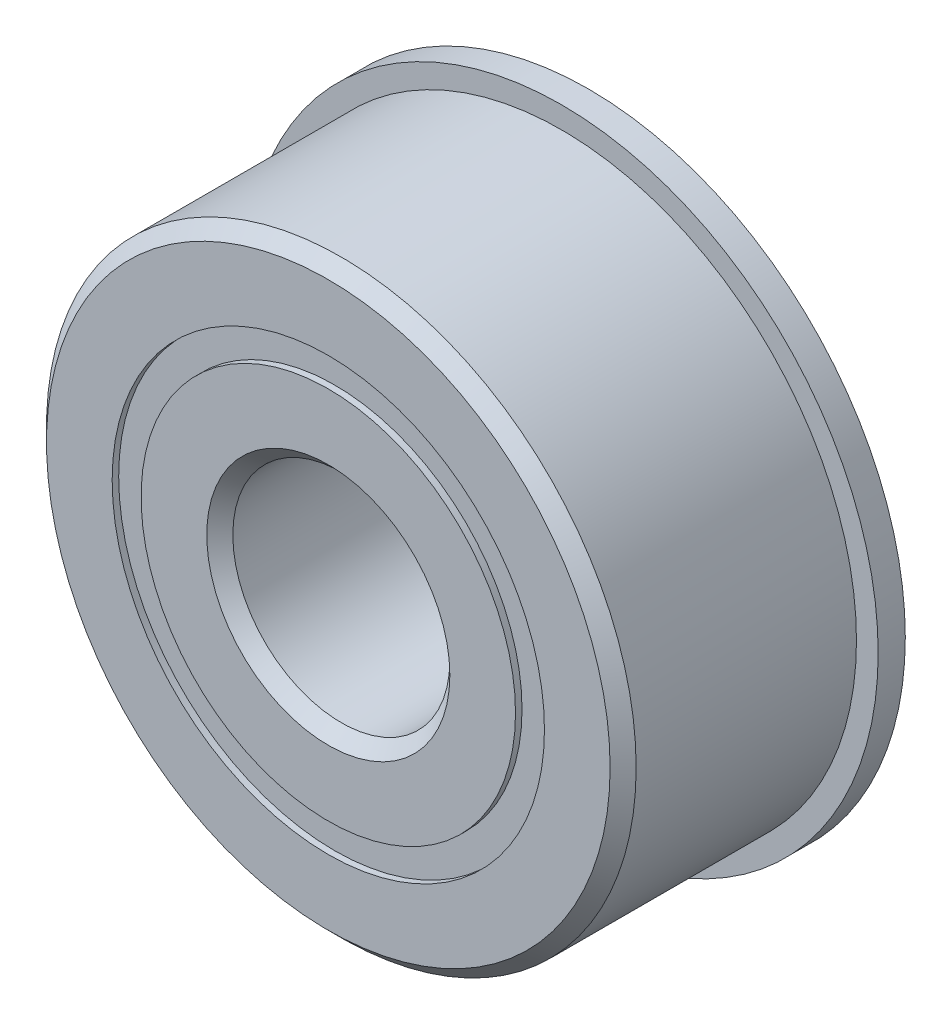
from build123d import *

# Parameters (mm, degrees)
CIRPATTERN1_COUNT = 8
SKETCH5_W         = 1.77075775
SKETCH5_H         = 0.8
SKETCH6_W         = 0.75
SKETCH6_H         = 2.775


with BuildPart() as part:
    # Sketch1 → Revolve1 (revolve)
    with BuildSketch(Plane(origin=(0, 0, 0), x_dir=(0, 0, -1), z_dir=(1, 0, 0))):
        with BuildLine():
            Line((3.24, 8.15), (-3.24, 8.15))
            Line((-3.24, 8.15), (-3.6, 7.79))
            Line((-3.6, 7.79), (-3.6, 5.975))
            Line((-3.6, 5.975), (-1.6, 5.975))
            ThreePointArc((-1.6, 5.975), (0, 7.22424225), (1.6, 5.975))
            Line((1.6, 5.975), (3.6, 5.975))
            Line((3.6, 5.975), (3.6, 7.79))
            Line((3.6, 7.79), (3.24, 8.15))
        make_face()
    revolve(axis=Axis((0, 0, 3.6), (0, 0, -1)))

    # Sketch6 → Revolve6 (revolve)
    with BuildSketch(Plane(origin=(0, 0, 0), x_dir=(0, 0, -1), z_dir=(1, 0, 0))):
        with Locations((3.225, 7.3625)):
            Rectangle(SKETCH6_W, SKETCH6_H)
    revolve(axis=Axis((0, 0, -3.6), (0, 0, 1)))


with BuildPart() as body_2:
    # Sketch3 → Revolve3 (revolve)
    with BuildSketch(Plane(origin=(0, 0, 0), x_dir=(0, 0, -1), z_dir=(1, 0, 0))):
        with BuildLine():
            Line((-3.6, 5.175), (-1.6, 5.175))
            ThreePointArc((-1.6, 5.175), (0, 3.92575775), (1.6, 5.175))
            Line((1.6, 5.175), (3.6, 5.175))
            Line((3.6, 5.175), (3.6, 3.36))
            Line((3.6, 3.36), (3.24, 3))
            Line((3.24, 3), (-3.24, 3))
            Line((-3.24, 3), (-3.6, 3.36))
            Line((-3.6, 3.36), (-3.6, 5.175))
        make_face()
    revolve(axis=Axis((0, 0, 3.6), (0, 0, -1)))


with BuildPart() as body_3:
    # Sketch4 → Revolve4 (revolve)
    with BuildSketch(Plane(origin=(0, 0, 0), x_dir=(0, 0, -1), z_dir=(1, 0, 0))):
        with BuildLine():
            Line((-1.64924225, 5.575), (1.64924225, 5.575))
            ThreePointArc((1.64924225, 5.575), (0, 7.22424225), (-1.64924225, 5.575))
        make_face()
    revolve(axis=Axis((0, 5.575, 1.64924225), (0, 0, -1)))


with BuildPart() as cirpattern1_1:
    # CirPattern1: pattern copy
    add(body_3.part.rotate(Axis((0, 0, -3.6), (0, 0, 1)), 1 * 360 / CIRPATTERN1_COUNT))


with BuildPart() as cirpattern1_2:
    # CirPattern1: pattern copy
    add(body_3.part.rotate(Axis((0, 0, -3.6), (0, 0, 1)), 2 * 360 / CIRPATTERN1_COUNT))


with BuildPart() as cirpattern1_3:
    # CirPattern1: pattern copy
    add(body_3.part.rotate(Axis((0, 0, -3.6), (0, 0, 1)), 3 * 360 / CIRPATTERN1_COUNT))


with BuildPart() as cirpattern1_4:
    # CirPattern1: pattern copy
    add(body_3.part.rotate(Axis((0, 0, -3.6), (0, 0, 1)), 4 * 360 / CIRPATTERN1_COUNT))


with BuildPart() as cirpattern1_5:
    # CirPattern1: pattern copy
    add(body_3.part.rotate(Axis((0, 0, -3.6), (0, 0, 1)), 5 * 360 / CIRPATTERN1_COUNT))


with BuildPart() as cirpattern1_6:
    # CirPattern1: pattern copy
    add(body_3.part.rotate(Axis((0, 0, -3.6), (0, 0, 1)), 6 * 360 / CIRPATTERN1_COUNT))


with BuildPart() as cirpattern1_7:
    # CirPattern1: pattern copy
    add(body_3.part.rotate(Axis((0, 0, -3.6), (0, 0, 1)), 7 * 360 / CIRPATTERN1_COUNT))


with BuildPart() as body_11:
    # Sketch5 → Revolve5 (revolve)
    with BuildSketch(Plane(origin=(0, 0, 0), x_dir=(0, 0, -1), z_dir=(1, 0, 0))):
        with Locations((-2.534621125, 5.575)):
            Rectangle(SKETCH5_W, SKETCH5_H)
        with Locations((2.534621125, 5.575)):
            Rectangle(SKETCH5_W, SKETCH5_H)
    revolve(axis=Axis((0, 0, 3.6), (0, 0, -1)))


solid = Compound([part.part, body_2.part, body_3.part, cirpattern1_1.part, cirpattern1_2.part, cirpattern1_3.part, cirpattern1_4.part, cirpattern1_5.part, cirpattern1_6.part, cirpattern1_7.part, body_11.part])
